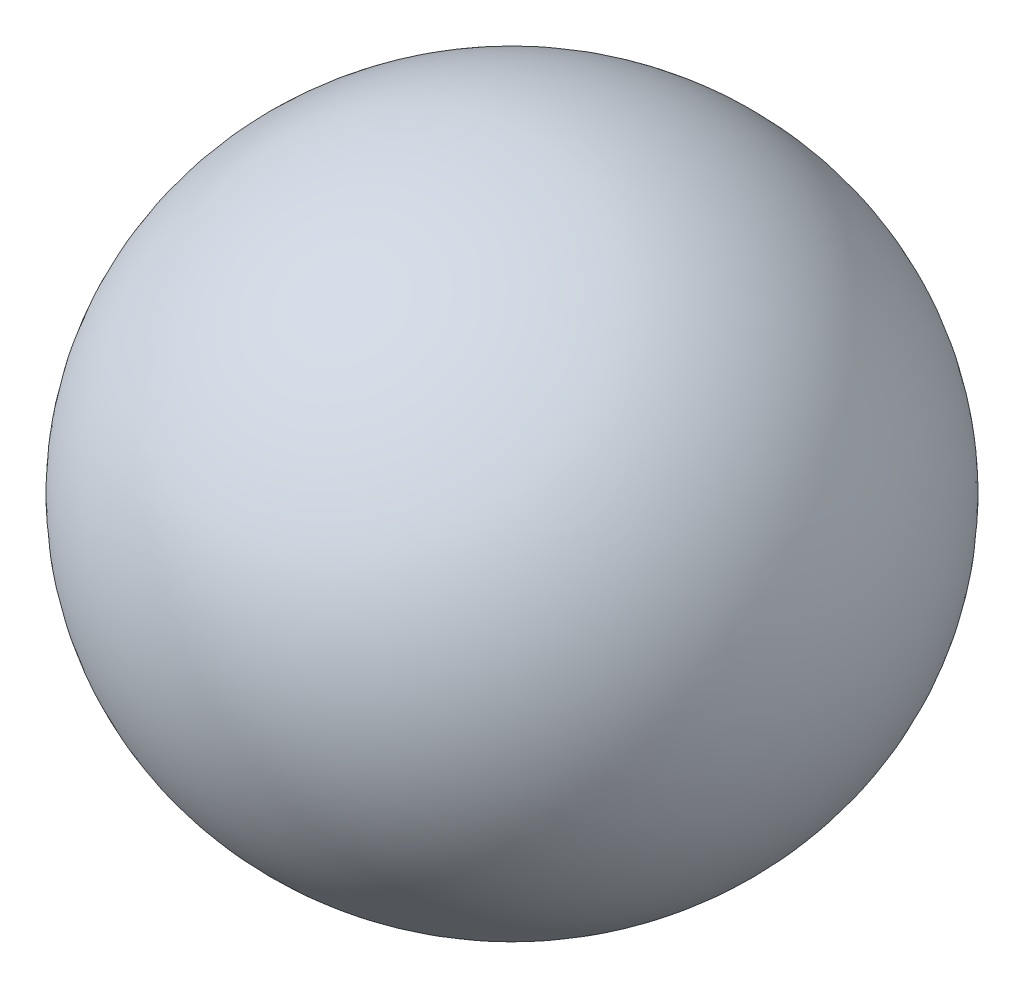
from build123d import *


with BuildPart() as part:
    # Sketch2 → Revolve1 (revolve)
    with BuildSketch(Plane.XY):
        with BuildLine():
            Line((0, 0), (0, 40.64))
            add(Edge.make_bspline(
                [(43.18, 0), (43.18, 40.64), (0, 40.64)],
                knots=[0, 0, 0, 1.570796327, 1.570796327, 1.570796327], degree=2, weights=[1, 0.707106781, 1]))
            Line((43.18, 0), (0, 0))
        make_face()
    revolve1 = revolve(axis=Axis((0, 0, 0), (0, 1, 0)))

    # Mirror1: Revolve1 across plane
    add(revolve1.mirror(Plane(origin=(0, 0, 0), x_dir=(0, 0, 1), z_dir=(0, -1, 0))))


solid = part.part
